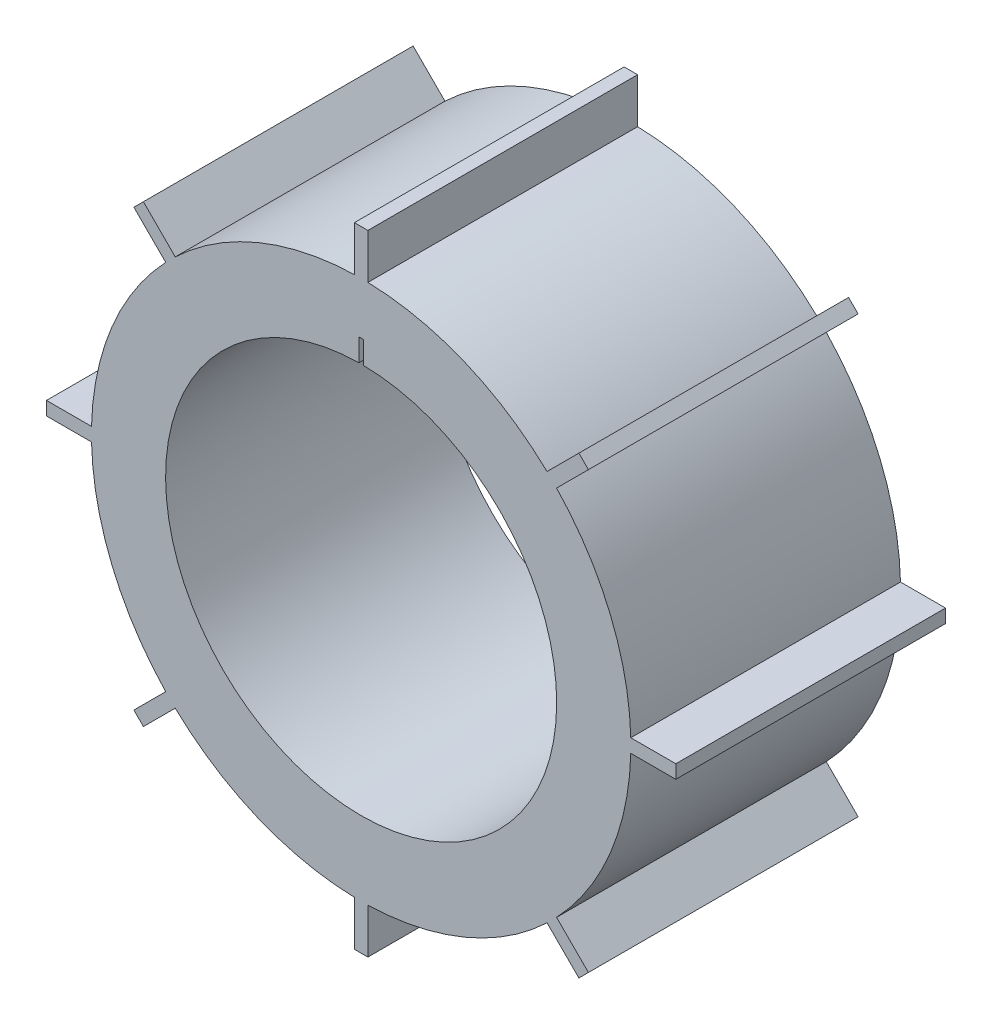
from build123d import *

# Parameters (mm, degrees)
SKETCH1_R           = 60
SKETCH1_R_2         = 43.5
EXTRUSION1_DEPTH    = 60
EXTRUSION3_START    = -60
EXTRUSION3_DEPTH    = 60
BOSS_EXTRUDE1_DEPTH = 60


with BuildPart() as part:
    # Sketch1 → Extrusion1 (new body)
    with BuildSketch(Plane.XY):
        Circle(SKETCH1_R)
        Circle(SKETCH1_R_2, mode=Mode.SUBTRACT)
    extrude(amount=EXTRUSION1_DEPTH)

    # Sketch3 → Extrusion3 (cut)
    with BuildSketch(Plane.XY.offset(60).offset(EXTRUSION3_START)):
        with BuildLine():
            Line((-0.5, 48.5), (-0.5, 43.497126342))
            ThreePointArc((-0.5, 43.497126342), (0, 43.5), (0.5, 43.497126342))
            Line((0.5, 43.497126342), (0.5, 48.5))
            Line((0.5, 48.5), (-0.5, 48.5))
        make_face()
    extrude(amount=EXTRUSION3_DEPTH, mode=Mode.SUBTRACT)

    # Sketch4 → Boss-Extrude1 (add, through all)
    with BuildSketch(Plane.XY.offset(60)):
        with BuildLine():
            Line((41.352486375, 43.473806719), (48.436814511, 50.558134855))
            Line((48.436814511, 50.558134855), (50.558134855, 48.436814511))
            Line((50.558134855, 48.436814511), (43.473806719, 41.352486375))
            ThreePointArc((43.473806719, 41.352486375), (42.426406871, 42.426406871), (41.352486375, 43.473806719))
        make_face()
        with BuildLine():
            Line((1.5, 59.981247069), (1.5, 70))
            Line((1.5, 70), (-1.5, 70))
            Line((-1.5, 70), (-1.5, 59.981247069))
            ThreePointArc((-1.5, 59.981247069), (0, 60), (1.5, 59.981247069))
        make_face()
        with BuildLine():
            Line((59.981247069, 1.5), (70, 1.5))
            Line((70, 1.5), (70, -1.5))
            Line((70, -1.5), (59.981247069, -1.5))
            ThreePointArc((59.981247069, -1.5), (60, 0), (59.981247069, 1.5))
        make_face()
        with BuildLine():
            Line((43.473806719, -41.352486375), (50.558134855, -48.436814511))
            Line((50.558134855, -48.436814511), (48.436814511, -50.558134855))
            Line((48.436814511, -50.558134855), (41.352486375, -43.473806719))
            ThreePointArc((41.352486375, -43.473806719), (42.426406871, -42.426406871), (43.473806719, -41.352486375))
        make_face()
        with BuildLine():
            Line((1.5, -59.981247069), (1.5, -70))
            Line((1.5, -70), (-1.5, -70))
            Line((-1.5, -70), (-1.5, -59.981247069))
            ThreePointArc((-1.5, -59.981247069), (0, -60), (1.5, -59.981247069))
        make_face()
        with BuildLine():
            Line((-41.352486375, -43.473806719), (-48.436814511, -50.558134855))
            Line((-48.436814511, -50.558134855), (-50.558134855, -48.436814511))
            Line((-50.558134855, -48.436814511), (-43.473806719, -41.352486375))
            ThreePointArc((-43.473806719, -41.352486375), (-42.426406871, -42.426406871), (-41.352486375, -43.473806719))
        make_face()
        with BuildLine():
            Line((-59.981247069, -1.5), (-70, -1.5))
            Line((-70, -1.5), (-70, 1.5))
            Line((-70, 1.5), (-59.981247069, 1.5))
            ThreePointArc((-59.981247069, 1.5), (-60, 0), (-59.981247069, -1.5))
        make_face()
        with BuildLine():
            Line((-43.473806719, 41.352486375), (-50.558134855, 48.436814511))
            Line((-50.558134855, 48.436814511), (-48.436814511, 50.558134855))
            Line((-48.436814511, 50.558134855), (-41.352486375, 43.473806719))
            ThreePointArc((-41.352486375, 43.473806719), (-42.426406871, 42.426406871), (-43.473806719, 41.352486375))
        make_face()
    extrude(amount=-BOSS_EXTRUDE1_DEPTH)


solid = part.part
